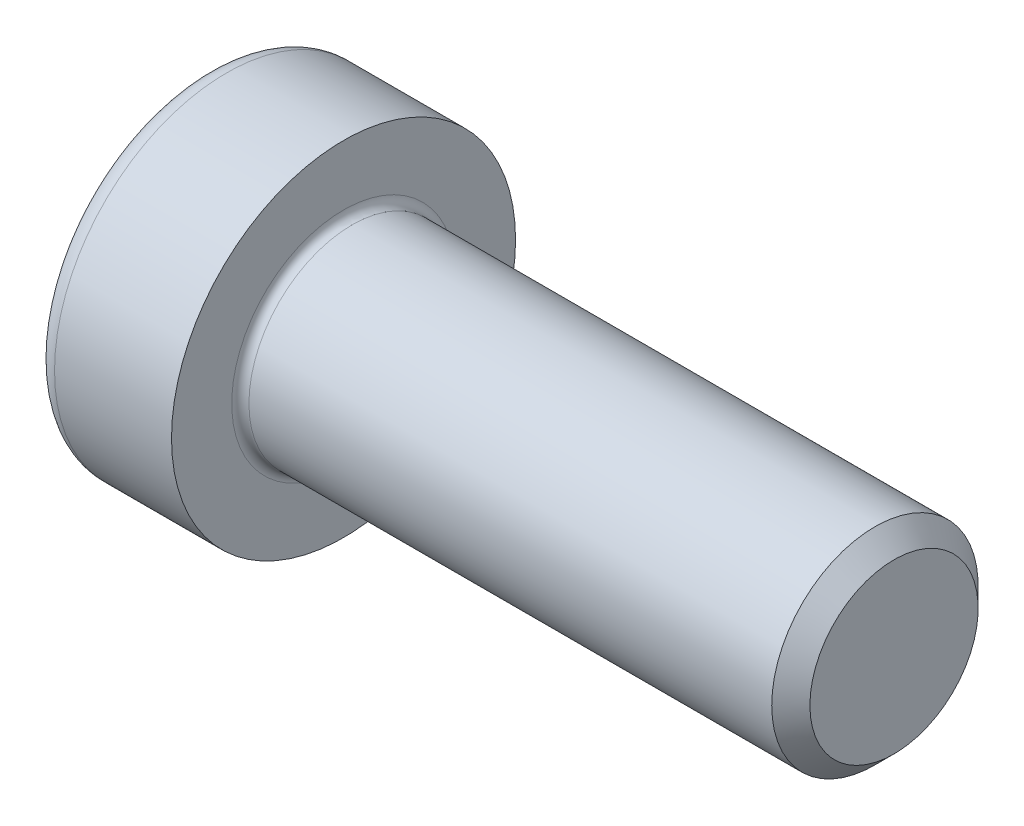
from build123d import *

# Parameters (mm, degrees)
FILLET1_R   = 0.25
FILLET2_R   = 0.6
HEX_2_DEPTH = 2.5


with BuildPart() as part:
    # BodySke → Base-Revolve (revolve)
    with BuildSketch(Plane.XY, mode=Mode.PRIVATE) as base_revolve_sk:
        Polygon((0, 0), (0, 5), (4, 5), (4, 3), (19.4455, 3), (20, 2.4455), (20, 0), align=None)
    revolve(base_revolve_sk.sketch.rotate(Axis((-31.75, 0, 0), (1, 0, 0)), 90), axis=Axis((-31.75, 0, 0), (1, 0, 0)))

    # Fillet1
    fillet1_edges = [part.edges().sort_by_distance(p)[0] for p in [
        (4, 0, -3),
    ]]
    fillet(fillet1_edges, radius=FILLET1_R)

    # Fillet2
    fillet2_edges = [part.edges().sort_by_distance(p)[0] for p in [
        (0, 0, -5),
    ]]
    fillet(fillet2_edges, radius=FILLET2_R)

    # HexSke → Hex 2 (cut)
    with BuildSketch(Plane(origin=(0, 0, 0), x_dir=(0, 0.500000000000001, 0.866025403784438), z_dir=(-1, 0, 0))):
        Polygon((1.443375673, 2.5), (-1.443375673, 2.5), (-2.886751346, 0), (-1.443375673, -2.5), (1.443375673, -2.5), (2.886751346, 0), align=None)
    extrude(amount=-HEX_2_DEPTH, mode=Mode.SUBTRACT)

    # PilotSke → Hex-PreBroach (revolve, cut)
    with BuildSketch(Plane.XY, mode=Mode.PRIVATE) as hex_prebroach_sk:
        Polygon((0, 2.5), (2.5, 2.5), (3.077350269, 1.5), (5, 1.5), (5.866025404, 0), (0, 0), align=None)
    revolve(hex_prebroach_sk.sketch.rotate(Axis((0, 0, 0), (1, 0, 0)), 90), axis=Axis((0, 0, 0), (1, 0, 0)), mode=Mode.SUBTRACT)


solid = part.part
